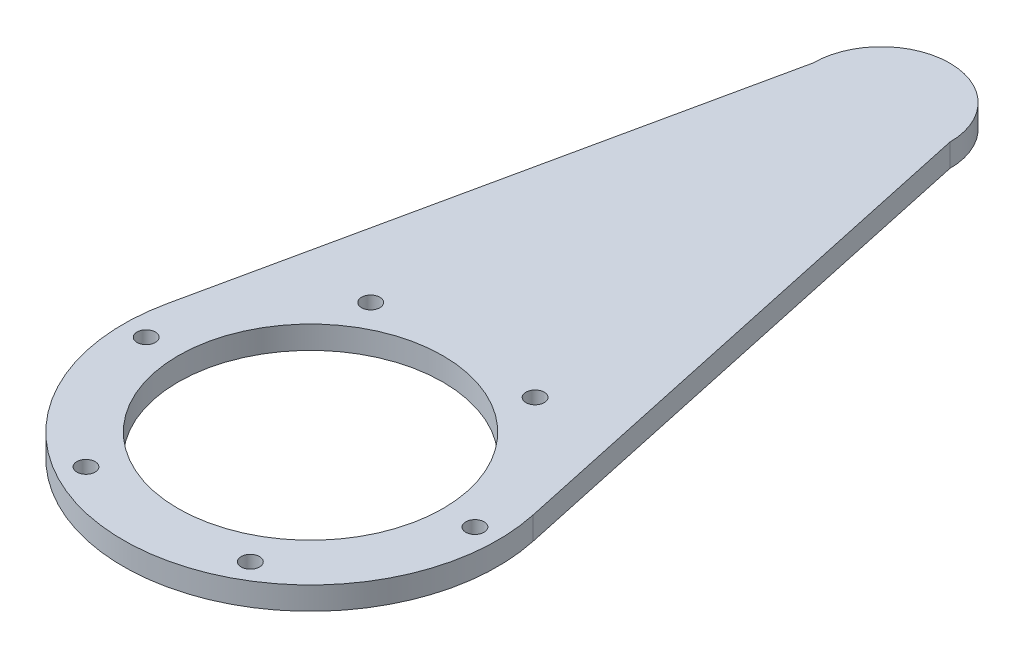
from build123d import *

# Parameters (mm, degrees)
SKETCH1_R           = 29
SKETCH1_R_2         = 2
BOSS_EXTRUDE1_DEPTH = 5


with BuildPart() as part:
    # Sketch1 → Boss-Extrude1 (new body)
    with BuildSketch(Plane(origin=(0, 0, 0), x_dir=(1, 0, 0), z_dir=(0, 1, 0))):
        with BuildLine():
            Line((-15, 125), (-40.079636882, 8.638443574))
            ThreePointArc((-40.079636882, 8.638443574), (0, -41), (40.079636882, 8.638443574))
            Line((40.079636882, 8.638443574), (15, 125))
            ThreePointArc((15, 125), (0, 140), (-15, 125))
        make_face()
        Circle(SKETCH1_R, mode=Mode.SUBTRACT)
        with Locations((36, 0)):
            Circle(SKETCH1_R_2, mode=Mode.SUBTRACT)
        with Locations((18, -31.176914536)):
            Circle(SKETCH1_R_2, mode=Mode.SUBTRACT)
        with Locations((-18, -31.176914536)):
            Circle(SKETCH1_R_2, mode=Mode.SUBTRACT)
        with Locations((-36, 0)):
            Circle(SKETCH1_R_2, mode=Mode.SUBTRACT)
        with Locations((-18, 31.176914536)):
            Circle(SKETCH1_R_2, mode=Mode.SUBTRACT)
        with Locations((18, 31.176914536)):
            Circle(SKETCH1_R_2, mode=Mode.SUBTRACT)
    extrude(amount=BOSS_EXTRUDE1_DEPTH)


solid = part.part
